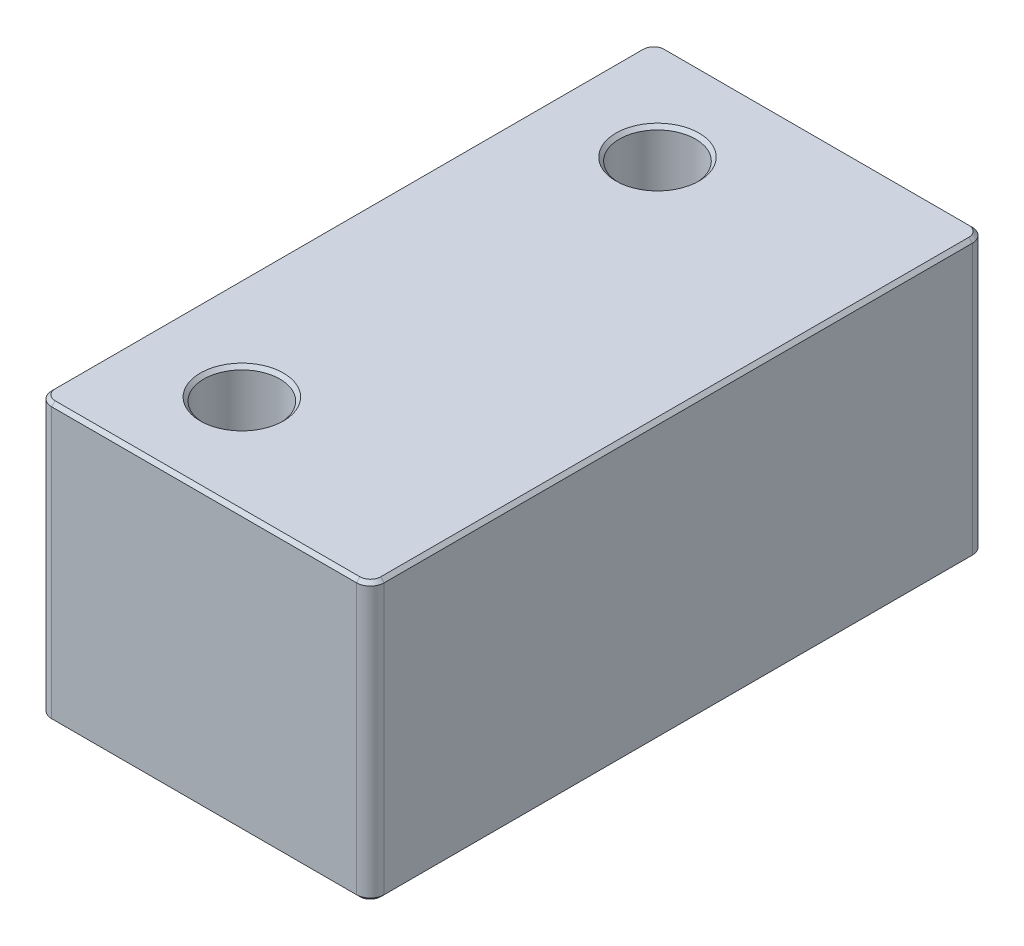
from build123d import *

# Parameters (mm, degrees)
SKETCH1_W            = 24
SKETCH1_H            = 44.45
BOSS_EXTRUDE1_DEPTH  = 20
M5_CLEARANCE_HOLE1_D = 5.5
BOSS_EXTRUDE2_START  = -20
SKETCH4_R            = 2.75
BOSS_EXTRUDE2_DEPTH  = 20
FILLET1_R            = 1
CHAMFER1_SIZE        = 0.25


with BuildPart() as part:
    # Sketch1 → Boss-Extrude1 (new body)
    with BuildSketch(Plane(origin=(0, 0, 0), x_dir=(1, 0, 0), z_dir=(0, 1, 0))):
        Rectangle(SKETCH1_W, SKETCH1_H)
    extrude(amount=BOSS_EXTRUDE1_DEPTH)

    # M5 Clearance Hole1 (through all)
    with Locations(Plane(origin=(0, 20, 0), x_dir=(1, 0, 0), z_dir=(0, 1, 0))):
        with Locations((-4.5, 15), (-4.5, -15), (-4.5, 0)):
            Hole(M5_CLEARANCE_HOLE1_D / 2)

    # Sketch4 → Boss-Extrude2 (add)
    with BuildSketch(Plane(origin=(0, 20, 0), x_dir=(1, 0, 0), z_dir=(0, 1, 0)).offset(BOSS_EXTRUDE2_START)):
        with Locations((-4.5, 0)):
            Circle(SKETCH4_R)
    extrude(amount=BOSS_EXTRUDE2_DEPTH)

    # Fillet1
    fillet1_edges = [part.edges().sort_by_distance(p)[0] for p in [
        (-12, 10, -22.225),
        (12, 10, -22.225),
        (12, 10, 22.225),
        (-12, 10, 22.225),
    ]]
    fillet(fillet1_edges, radius=FILLET1_R)

    # Chamfer1
    chamfer1_edges = [part.edges().sort_by_distance(p)[0] for p in [
        (-1.75, 20, 15),
        (-1.75, 0, 15),
        (-1.75, 20, -15),
        (-1.75, 0, -15),
        (-12, 0, 0),
        (-12, 20, 0),
        (0, 0, -22.225),
        (12, 0, 0),
        (0, 0, 22.225),
        (-11.707106781, 0, 21.932106781),
        (11.707106781, 0, 21.932106781),
        (11.707106781, 0, -21.932106781),
        (-11.707106781, 0, -21.932106781),
        (0, 20, -22.225),
        (0, 20, 22.225),
        (12, 20, 0),
        (-11.707106781, 20, 21.932106781),
        (11.707106781, 20, 21.932106781),
        (11.707106781, 20, -21.932106781),
        (-11.707106781, 20, -21.932106781),
    ]]
    chamfer(chamfer1_edges, length=CHAMFER1_SIZE)


solid = part.part
